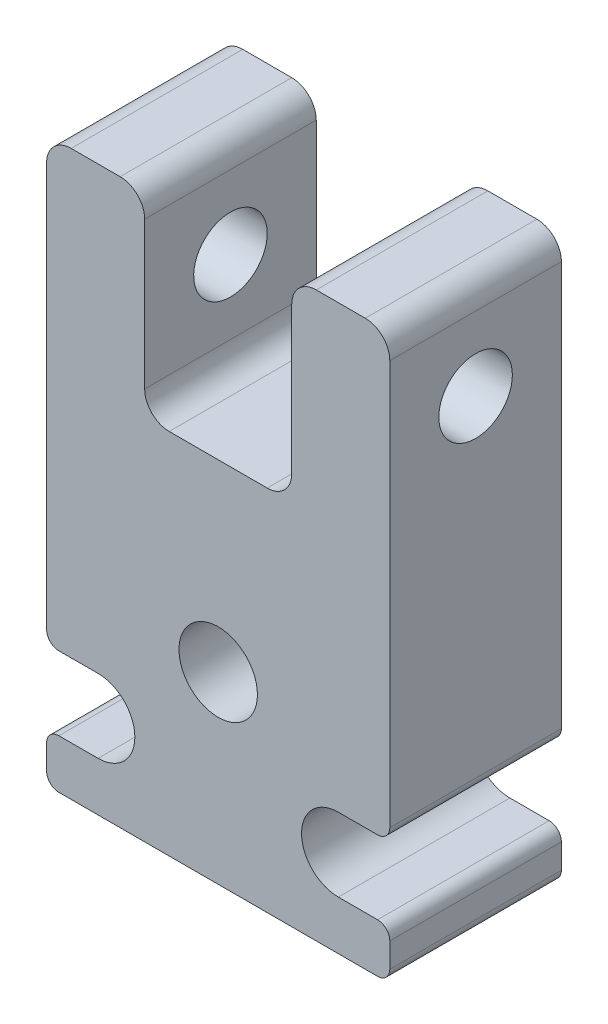
from build123d import *

# Parameters (mm, degrees)
CROQUIS1_R                 = 1.6
SALIENTE_EXTRUIR1_DEPTH    = 3.5
CORTAR_EXTRUIR1_DEPTH      = 14.910427743
CORTAR_EXTRUIR1_DEPTH_BACK = 14.910427743
CROQUIS2_R                 = 1.5
REDONDEO1_R                = 1
REDONDEO2_R                = 0.5


with BuildPart() as part:
    # Croquis1 → Saliente-Extruir1 (new, symmetric)
    with BuildSketch(Plane.XY):
        with BuildLine():
            Line((3, 11.5), (7, 11.5))
            Line((7, 11.5), (7, -6.5))
            Line((7, -6.5), (4.9, -6.5))
            ThreePointArc((4.9, -6.5), (3.4, -8), (4.9, -9.5))
            Line((4.9, -9.5), (7, -9.5))
            Line((7, -9.5), (7, -11.5))
            Line((7, -11.5), (-7, -11.5))
            Line((-7, -11.5), (-7, -9.5))
            Line((-7, -9.5), (-4.9, -9.5))
            ThreePointArc((-4.9, -9.5), (-3.4, -8), (-4.9, -6.5))
            Line((-4.9, -6.5), (-7, -6.5))
            Line((-7, -6.5), (-7, 11.5))
            Line((-7, 11.5), (-3, 11.5))
            Line((-3, 11.5), (-3, 3.5))
            Line((-3, 3.5), (3, 3.5))
            Line((3, 3.5), (3, 11.5))
        make_face()
        with Locations((0, -4)):
            Circle(CROQUIS1_R, mode=Mode.SUBTRACT)
    extrude(amount=SALIENTE_EXTRUIR1_DEPTH, both=True)

    # Croquis2 → Cortar-Extruir1 (cut, two sides: drawn at the far end of the back side and taken through both)
    with BuildSketch(Plane(origin=(0, 0, 0), x_dir=(0, 0, -1), z_dir=(1, 0, 0)).offset(-CORTAR_EXTRUIR1_DEPTH_BACK)):
        with Locations((0, 7.5)):
            Circle(CROQUIS2_R)
    extrude(amount=CORTAR_EXTRUIR1_DEPTH + CORTAR_EXTRUIR1_DEPTH_BACK, mode=Mode.SUBTRACT)

    # Redondeo1
    redondeo1_edges = [part.edges().sort_by_distance(p)[0] for p in [
        (-7, 11.5, 0),
        (-3, 11.5, 0),
        (-3, 3.5, 0),
        (3, 3.5, 0),
        (3, 11.5, 0),
        (7, 11.5, 0),
    ]]
    fillet(redondeo1_edges, radius=REDONDEO1_R)

    # Redondeo2
    redondeo2_edges = [part.edges().sort_by_distance(p)[0] for p in [
        (7, -11.5, 0),
        (-7, -11.5, 0),
        (-7, -9.5, 0),
        (-7, -6.5, 0),
        (7, -6.5, 0),
        (7, -9.5, 0),
    ]]
    fillet(redondeo2_edges, radius=REDONDEO2_R)


solid = part.part
